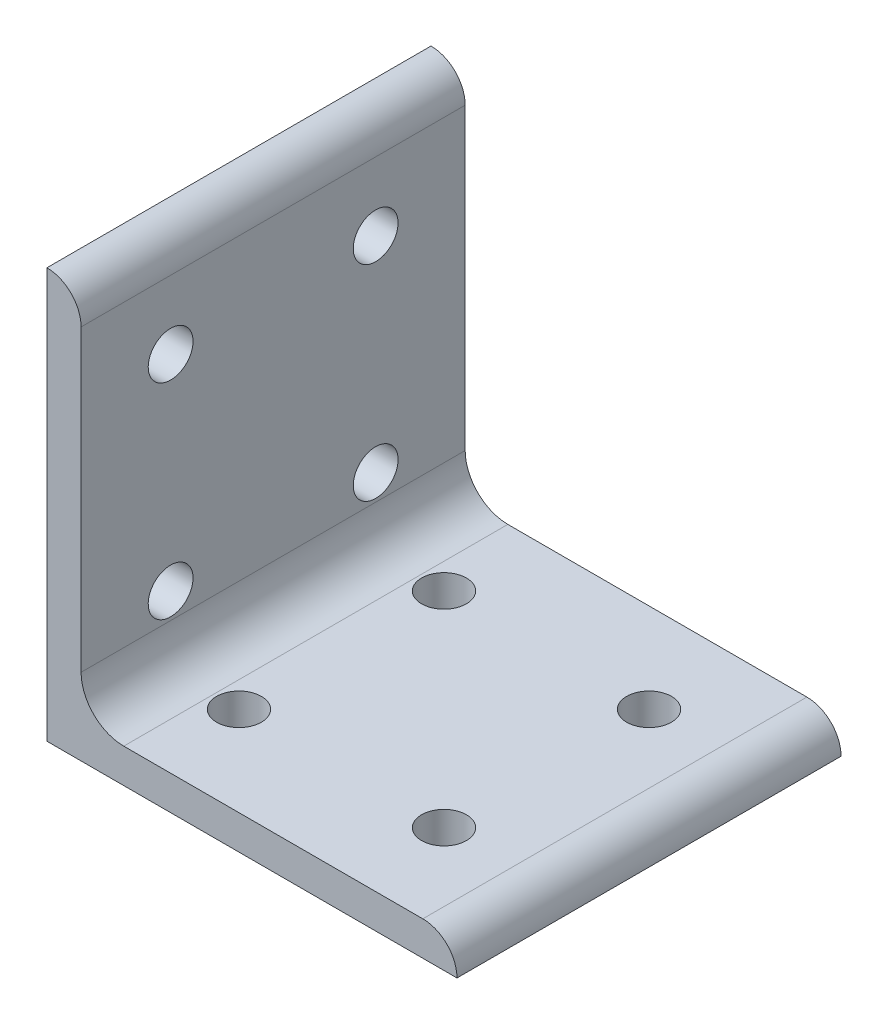
from build123d import *

# Parameters (mm, degrees)
BOSS_EXTRUDE1_DEPTH = 35.687
SKETCH2_R           = 4.1656
CUT_EXTRUDE1_DEPTH  = 114.518465322
SKETCH3_R           = 4.1656
CUT_EXTRUDE2_DEPTH  = 114.518465322


with BuildPart() as part:
    # Sketch1 → Boss-Extrude1 (new, symmetric)
    with BuildSketch(Plane.XY):
        with BuildLine():
            Line((0, 0), (0, 76.2))
            ThreePointArc((0, 76.2), (4.490128061, 74.340128061), (6.35, 69.85))
            Line((6.35, 69.85), (6.35, 14.2748))
            ThreePointArc((6.35, 14.2748), (8.67112018, 8.67112018), (14.2748, 6.35))
            Line((14.2748, 6.35), (69.85, 6.35))
            ThreePointArc((69.85, 6.35), (74.340128061, 4.490128061), (76.2, 0))
            Line((76.2, 0), (0, 0))
        make_face()
    extrude(amount=BOSS_EXTRUDE1_DEPTH, both=True)

    # Sketch2 → Cut-Extrude1 (cut, through all)
    with BuildSketch(Plane(origin=(0, 0, 0), x_dir=(1, 0, 0), z_dir=(0, 1, 0))):
        with Locations(Location((19.05, -19.05, 0), (0, 0, 90))):
            Circle(SKETCH2_R)
        with Locations(Location((57.15, -19.05, 0), (0, 0, 90))):
            Circle(SKETCH2_R)
        with Locations(Location((19.05, 19.05, 0), (0, 0, 90))):
            Circle(SKETCH2_R)
        with Locations(Location((57.15, 19.05, 0), (0, 0, 90))):
            Circle(SKETCH2_R)
    extrude(amount=CUT_EXTRUDE1_DEPTH, mode=Mode.SUBTRACT)

    # Sketch3 → Cut-Extrude2 (cut, through all)
    with BuildSketch(Plane(origin=(0, 0, 0), x_dir=(0, 0, -1), z_dir=(1, 0, 0))):
        with Locations(Location((-19.05, 19.05, 0), (0, 0, 270))):
            Circle(SKETCH3_R)
        with Locations(Location((-19.05, 57.15, 0), (0, 0, 270))):
            Circle(SKETCH3_R)
        with Locations(Location((19.05, 19.05, 0), (0, 0, 270))):
            Circle(SKETCH3_R)
        with Locations(Location((19.05, 57.15, 0), (0, 0, 270))):
            Circle(SKETCH3_R)
    extrude(amount=CUT_EXTRUDE2_DEPTH, mode=Mode.SUBTRACT)


solid = part.part
